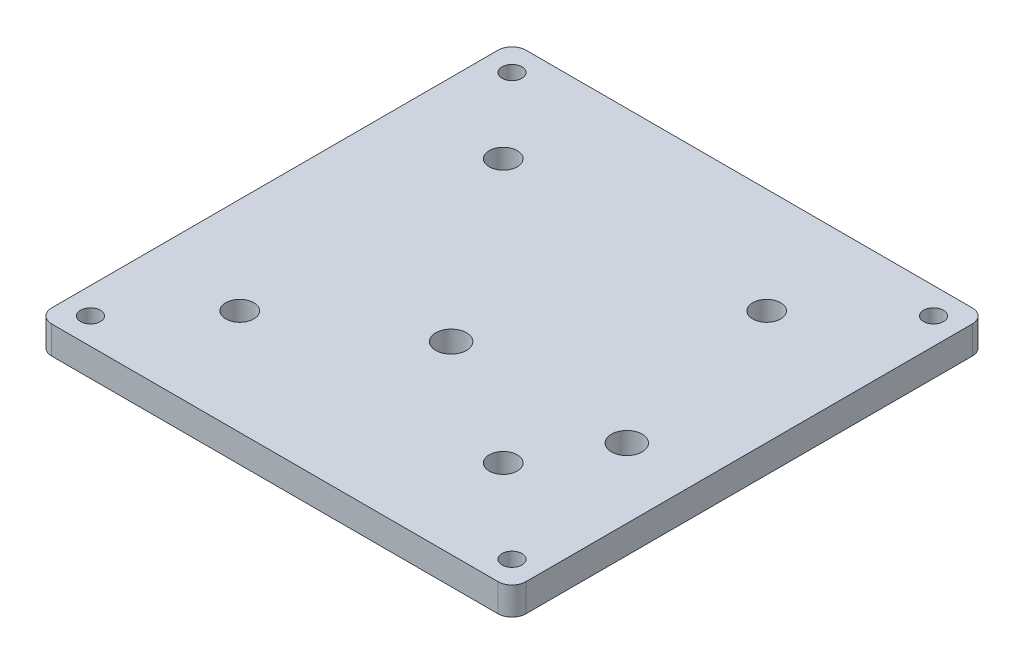
from build123d import *

# Parameters (mm, degrees)
SKETCH1_W             = 42
SKETCH1_H             = 54
SKETCH1_R             = 1.6
SKETCH1_R_2           = 1.75
BOSS_EXTRUDE1_DEPTH   = 3.175
SKETCH2_W             = 6
SKETCH2_H             = 54
BOSS_EXTRUDE2_DEPTH   = 3.175
F_4_40_TAPPED_HOLE1_D = 2.2606
FILLET1_R             = 1.5875


with BuildPart() as part:
    # Sketch1 → Boss-Extrude1 (new body)
    with BuildSketch(Plane(origin=(0, 0, 0), x_dir=(1, 0, 0), z_dir=(0, 1, 0))):
        with Locations((21, -22)):
            Rectangle(SKETCH1_W, SKETCH1_H)
        with Locations(Location((35, -7, 0), (0, 0, 270))):
            Circle(SKETCH1_R, mode=Mode.SUBTRACT)
        with Locations(Location((5, -37, 0), (0, 0, 270))):
            Circle(SKETCH1_R, mode=Mode.SUBTRACT)
        with Locations(Location((20.07, -28, 0), (0, 0, 270))):
            Circle(SKETCH1_R_2, mode=Mode.SUBTRACT)
        with Locations(Location((35, -37, 0), (0, 0, 270))):
            Circle(SKETCH1_R, mode=Mode.SUBTRACT)
        with Locations(Location((40.07, -28, 0), (0, 0, 270))):
            Circle(SKETCH1_R_2, mode=Mode.SUBTRACT)
        with Locations(Location((5, -7, 0), (0, 0, 270))):
            Circle(SKETCH1_R, mode=Mode.SUBTRACT)
    extrude(amount=BOSS_EXTRUDE1_DEPTH)

    # Sketch2 → Boss-Extrude2 (add)
    with BuildSketch(Plane(origin=(0, 3.175, 0), x_dir=(1, 0, 0), z_dir=(0, 1, 0))):
        with Locations((-3, -22)):
            Rectangle(SKETCH2_W, SKETCH2_H)
        with Locations((45, -22)):
            Rectangle(SKETCH2_W, SKETCH2_H)
    extrude(amount=-BOSS_EXTRUDE2_DEPTH)

    # #4-40 Tapped Hole1 (through all)
    with Locations(Plane(origin=(-3, 3.175, -2), x_dir=(0, 0, 1), z_dir=(0, 1, 0))):
        with Locations((0, 0), (48, 0), (0, 48), (48, 48)):
            Hole(F_4_40_TAPPED_HOLE1_D / 2)

    # Fillet1
    fillet1_edges = [part.edges().sort_by_distance(p)[0] for p in [
        (-6, 1.5875, -5),
        (-6, 1.5875, 49),
        (48, 1.5875, 49),
        (48, 1.5875, -5),
    ]]
    fillet(fillet1_edges, radius=FILLET1_R)


solid = part.part
